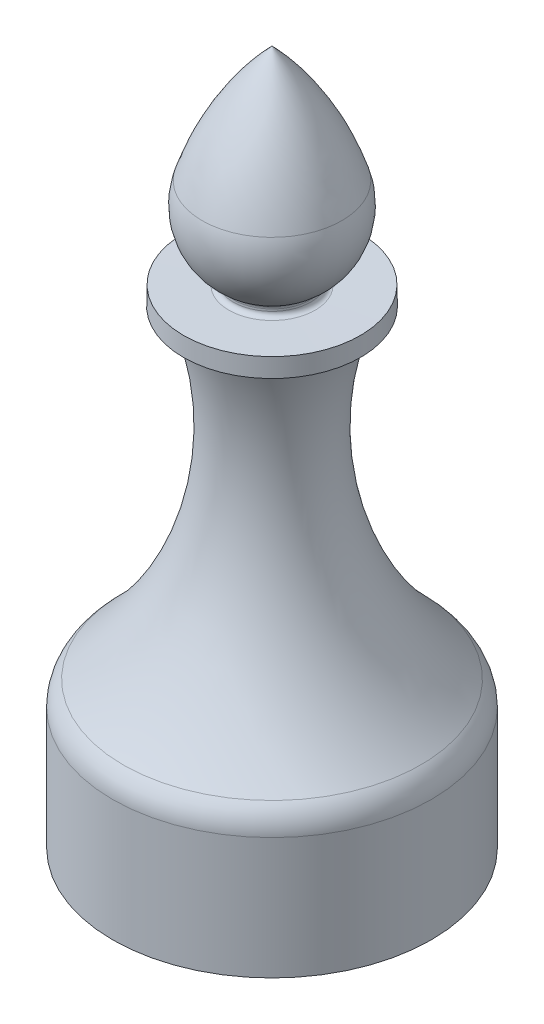
from build123d import *

# Parameters (mm, degrees)
FILLET1_R = 3


with BuildPart() as part:
    # Sketch1 → Revolve1 (revolve)
    with BuildSketch(Plane.XY, mode=Mode.PRIVATE) as revolve1_sk:
        with BuildLine():
            Line((9.5, 12), (9.5, 0))
            Line((9.5, 0), (14, 0))
            Line((14, 0), (14, 12))
            ThreePointArc((14, 12), (5.808899363, 24.991123715), (6.144902799, 40.3452934))
            Line((6.144902799, 40.3452934), (7.791407098, 41.20778213))
            Line((7.791407098, 41.20778213), (7.764668615, 42.858630405))
            Line((7.764668615, 42.858630405), (3.791041614, 42.794270306))
            ThreePointArc((3.791041614, 42.794270306), (3.509684474, 42.923205602), (3.394593546, 43.210503755))
            Line((3.394593546, 43.210503755), (3.39171112, 43.388466278))
            ThreePointArc((3.39171112, 43.388466278), (3.427062825, 43.564311584), (3.532381916, 43.709498374))
            ThreePointArc((3.532381916, 43.709498374), (6.047939548, 46.800239445), (6.141308054, 50.784206425))
            ThreePointArc((6.141308054, 50.784206425), (3.673190764, 56.254323111), (0, 61))
            Line((0, 61), (0, 27.143900008))
            Line((0, 27.143900008), (8.595760221, 14.867882182))
            ThreePointArc((8.595760221, 14.867882182), (9.268584754, 13.503528998), (9.5, 12))
        make_face()
    revolve(revolve1_sk.sketch.rotate(Axis((0, 61, 0), (0, -1, 0)), 90), axis=Axis((0, 61, 0), (0, -1, 0)))

    # Fillet1
    fillet1_edges = [part.edges().sort_by_distance(p)[0] for p in [
        (0, 12, -14),
    ]]
    fillet(fillet1_edges, radius=FILLET1_R)


solid = part.part
